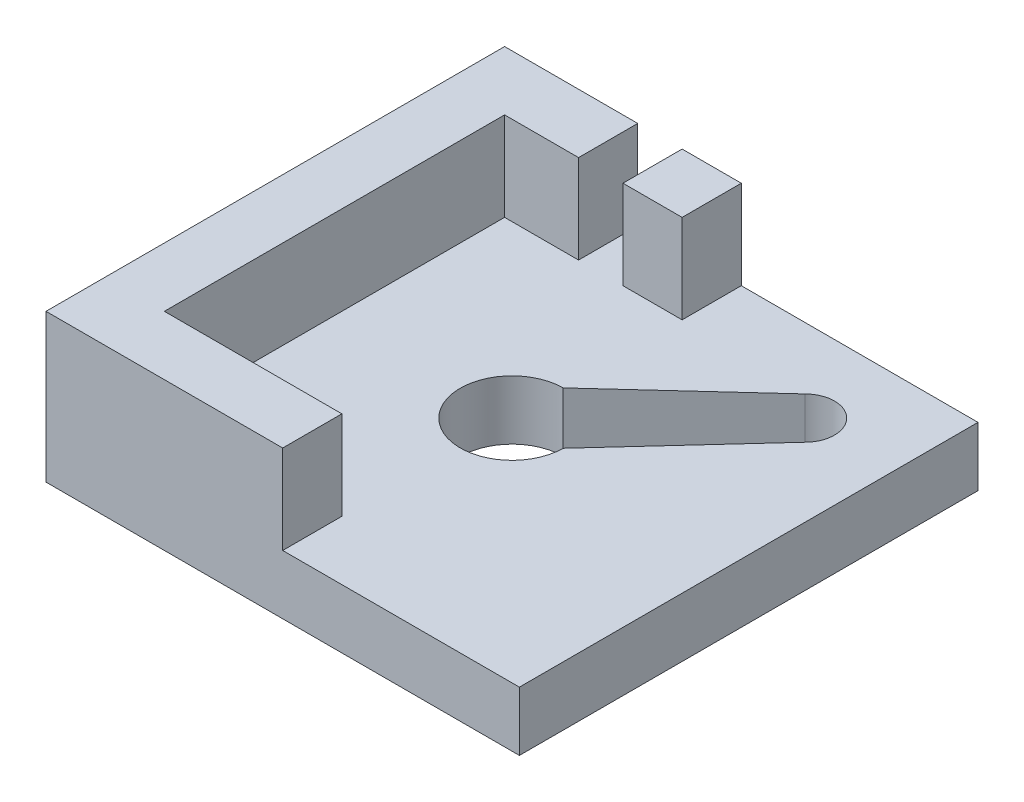
from build123d import *

# Parameters (mm, degrees)
SKETCH1_W           = 32
SKETCH1_H           = 31
BOSS_EXTRUDE1_DEPTH = 4
BOSS_EXTRUDE2_DEPTH = 6
SKETCH3_W           = 3
SKETCH3_H           = 4
CUT_EXTRUDE1_DEPTH  = 6
CUT_EXTRUDE6_DEPTH  = 4


with BuildPart() as part:
    # Sketch1 → Boss-Extrude1 (new body)
    with BuildSketch(Plane(origin=(0, 0, 0), x_dir=(1, 0, 0), z_dir=(0, 1, 0))):
        Rectangle(SKETCH1_W, SKETCH1_H)
    extrude(amount=BOSS_EXTRUDE1_DEPTH)

    # Sketch2 → Boss-Extrude2 (add)
    with BuildSketch(Plane(origin=(0, 4, 0), x_dir=(1, 0, 0), z_dir=(0, 1, 0))):
        Polygon((-16, 15.5), (-16, -15.5), (0, -15.5), (0, -11.5), (-12, -11.5), (-12, 11.5), (0, 11.5), (0, 15.5), align=None)
    extrude(amount=BOSS_EXTRUDE2_DEPTH)

    # Sketch3 → Cut-Extrude1 (cut)
    with BuildSketch(Plane(origin=(0, 10, 0), x_dir=(1, 0, 0), z_dir=(0, 1, 0))):
        with Locations((-5.5, 13.5)):
            Rectangle(SKETCH3_W, SKETCH3_H)
    extrude(amount=-CUT_EXTRUDE1_DEPTH, mode=Mode.SUBTRACT)

    # Sketch4 → Cut-Extrude6 (cut)
    with BuildSketch(Plane(origin=(0, 4, 0), x_dir=(0.7071067811864886, 0, -0.7071067811866065), z_dir=(0, 1, 0))):
        with BuildLine():
            Line((14, 2), (2.449489743, 2.5))
            ThreePointArc((2.449489743, 2.5), (3.226702194, 1.355873501), (3.5, 0))
            ThreePointArc((3.5, 0), (3.226702194, -1.355873501), (2.449489743, -2.5))
            Line((2.449489743, -2.5), (14, -2))
            ThreePointArc((14, -2), (15.414213562, -1.414213562), (16, 0))
            ThreePointArc((16, 0), (15.414213562, 1.414213562), (14, 2))
        make_face()
        with BuildLine():
            ThreePointArc((3.5, 0), (3.226702194, 1.355873501), (2.449489743, 2.5))
            ThreePointArc((2.449489743, 2.5), (-3.5, 0), (2.449489743, -2.5))
            ThreePointArc((2.449489743, -2.5), (3.226702194, -1.355873501), (3.5, 0))
        make_face()
    extrude(amount=-CUT_EXTRUDE6_DEPTH, mode=Mode.SUBTRACT)


solid = part.part
